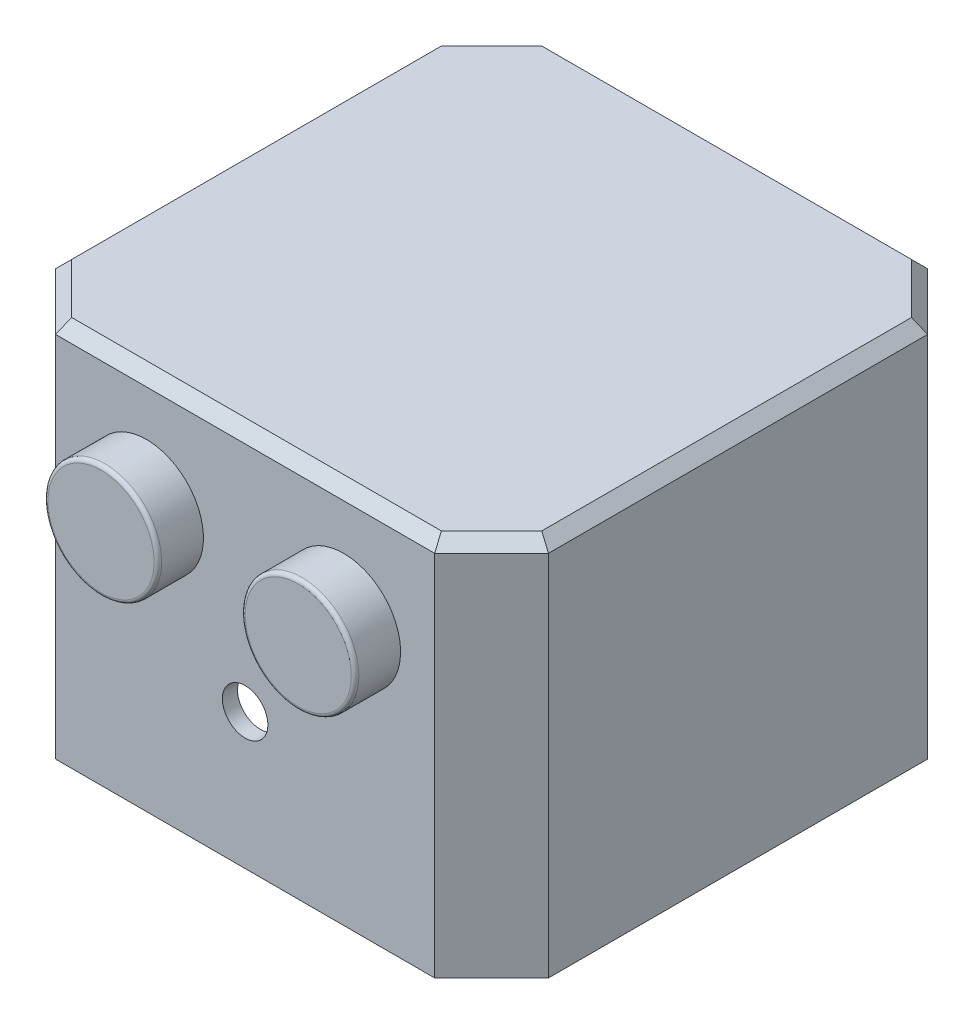
from build123d import *

# Parameters (mm, degrees)
SALIENTE_EXTRUIR1_DEPTH = 50
VACIADO2_T              = -2
CHAFL_N3_SIZE           = 1.5
CROQUIS2_R              = 7.5
SALIENTE_EXTRUIR2_DEPTH = 6
CROQUIS4_R              = 5
CORTAR_EXTRUIR2_DEPTH   = 5
REDONDEO1_R             = 0.5
CROQUIS5_R              = 3
CORTAR_EXTRUIR3_DEPTH   = 10
CROQUIS6_W              = 6
CROQUIS6_H              = 6
CORTAR_EXTRUIR4_DEPTH   = 10
CROQUIS7_W              = 4
CROQUIS7_H              = 4
SALIENTE_EXTRUIR3_DEPTH = 1


with BuildPart() as part:
    # Croquis1 → Saliente-Extruir1 (new body)
    with BuildSketch(Plane(origin=(0, 0, 0), x_dir=(1, 0, 0), z_dir=(0, 1, 0))):
        Polygon((-25, -32.5), (25, -32.5), (32.5, -25), (32.5, 25), (25, 32.5), (-25, 32.5), (-32.5, 25), (-32.5, -25), align=None)
    extrude(amount=SALIENTE_EXTRUIR1_DEPTH)

    # Vaciado2
    vaciado2_openings = [part.faces().sort_by_distance(p)[0] for p in [
        (0, 0, 0),
    ]]
    offset(amount=VACIADO2_T, openings=vaciado2_openings, kind=Kind.INTERSECTION)

    # Chaflán3
    chafl_n3_edges = [part.edges().sort_by_distance(p)[0] for p in [
        (-28.75, 50, -28.75),
        (-32.5, 50, 0),
        (-28.75, 50, 28.75),
        (0, 50, 32.5),
        (28.75, 50, 28.75),
        (32.5, 50, 0),
        (28.75, 50, -28.75),
        (0, 50, -32.5),
    ]]
    chamfer(chafl_n3_edges, length=CHAFL_N3_SIZE)

    # Croquis2 → Saliente-Extruir2 (add)
    with BuildSketch(Plane.XY.offset(32.5)):
        with Locations(Location((13, 35, 0), (0, 0, 180))):
            Circle(CROQUIS2_R)
        with Locations(Location((-13, 35, 0), (0, 0, 180))):
            Circle(CROQUIS2_R)
    extrude(amount=SALIENTE_EXTRUIR2_DEPTH)

    # Croquis4 → Cortar-Extruir2 (cut)
    with BuildSketch(Plane(origin=(0, 0, 30.5), x_dir=(-1, 0, 0), z_dir=(0, 0, -1))):
        with Locations((-13, 35)):
            Circle(CROQUIS4_R)
        with Locations(Location((13, 35, 0), (0, 0, 180))):
            Circle(CROQUIS4_R)
    extrude(amount=-CORTAR_EXTRUIR2_DEPTH, mode=Mode.SUBTRACT)

    # Redondeo1
    redondeo1_edges = [part.edges().sort_by_distance(p)[0] for p in [
        (20.5, 35, 38.5),
        (-5.5, 35, 38.5),
    ]]
    fillet(redondeo1_edges, radius=REDONDEO1_R)

    # Croquis5 → Cortar-Extruir3 (cut)
    with BuildSketch(Plane.XY.offset(32.5)):
        with Locations((0, 17.9)):
            Circle(CROQUIS5_R)
    extrude(amount=-CORTAR_EXTRUIR3_DEPTH, mode=Mode.SUBTRACT)

    # Croquis6 → Cortar-Extruir4 (cut)
    with BuildSketch(Plane(origin=(0, 0, -32.5), x_dir=(-1, 0, 0), z_dir=(0, 0, -1))):
        with Locations((-18, 6)):
            Rectangle(CROQUIS6_W, CROQUIS6_H)
    extrude(amount=-CORTAR_EXTRUIR4_DEPTH, mode=Mode.SUBTRACT)

    # Croquis7 → Saliente-Extruir3 (add)
    with BuildSketch(Plane(origin=(0, 0, 30.5), x_dir=(-1, 0, 0), z_dir=(0, 0, -1))):
        with Locations((-11.58, 9.3)):
            Rectangle(CROQUIS7_W, CROQUIS7_H)
        with Locations((-11.58, 26.8)):
            Rectangle(CROQUIS7_W, CROQUIS7_H)
        with Locations((11.43, 9.3)):
            Rectangle(CROQUIS7_W, CROQUIS7_H)
        with Locations((11.43, 26.8)):
            Rectangle(CROQUIS7_W, CROQUIS7_H)
    extrude(amount=SALIENTE_EXTRUIR3_DEPTH)


solid = part.part
